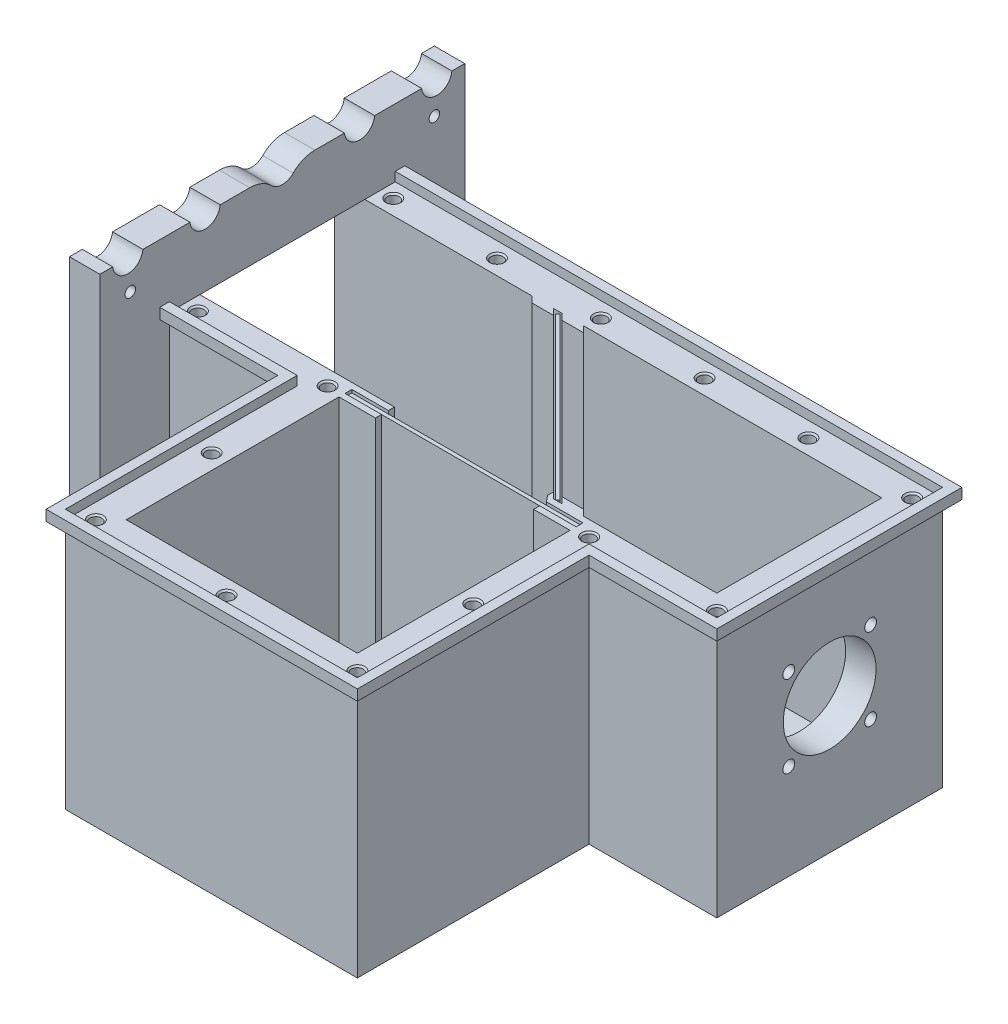
from build123d import *

# Parameters (mm, degrees)
FLOOR_2_DEPTH                         = 7
WALLS_START                           = 7
WALLS_DEPTH                           = 75.5
BEAM_START                            = 7
BEAM_SPLITTER_SUPPORTS_DEPTH          = 2
BEAM_SPLITTER_SUPPORTS_2_DEPTH        = 2
BEAM_SPLITTER_VERTICAL_SUPPORTS_DEPTH = 82.5
SM1_FLANGE_SKETCH_R                   = 15.25
SM1_FLANGE_SKETCH_R_2                 = 1.945
SM1_FLANGE_CUTOUT_DEPTH               = 10
BS_START                              = 7
BS_DIFFUSER_EXAMPLE_SKETCH_W          = 75
BS_DIFFUSER_EXAMPLE_SKETCH_H          = 1.25
BS_DIFFUSER_EXAMPLE_PLANES_DEPTH      = 75
BS_DIFFUSER_EXAMPLE_PLANES_2_DEPTH    = 75
CRYOSTAT_FLANGE_SKETCH_R              = 1.725
CRYOSTAT_FLANGE_SKETCH_W              = 54.24011537
CRYOSTAT_FLANGE_SKETCH_H              = 75.5
CRYSTAT_FLANGE_EXTRUSION_DEPTH        = 10
THREADED_INSERT_SKETCH_R              = 1.9431
CUT_EXTRUDE2_DEPTH                    = 10
CHAMFER1_SIZE                         = 0.5
BOSS_EXTRUDE12_DEPTH                  = 3
BOSS_EXTRUDE12_DEPTH_BACK             = 3
CHAMFER3_SIZE                         = 2.5
SKETCH8_R                             = 4.0767
F_1_4_20_SUPPORT_LEG_HOLES_DEPTH      = 6.35
FILLET1_R                             = 10


with BuildPart() as part:
    # Outline Sketch → Floor 2 (new body)
    with BuildSketch(Plane(origin=(0, 0, 0), x_dir=(1, 0, 0), z_dir=(0, 1, 0))):
        Polygon((10, -64.24011537), (52, -64.24011537), (52, -140.44011537), (148, -140.44011537), (148, -64.24011537), (190, -64.24011537), (190, 10), (10, 10), (10, 0), (0, 0), (0, -54.24011537), (10, -54.24011537), align=None)
    extrude(amount=FLOOR_2_DEPTH)

    # Sketch1<5> → Walls (add)
    with BuildSketch(Plane(origin=(0, 0, 0), x_dir=(1, 0, 0), z_dir=(0, 1, 0)).offset(WALLS_START)):
        Polygon((180, 0), (180, -54.24011537), (126, -54.24011537), (126, -56.24011537), (138, -56.24011537), (138, -58.49011537), (126, -58.49011537), (126, -60.49011537), (138, -60.49011537), (138, -130.44011537), (62, -130.44011537), (62, -60.49011537), (74, -60.49011537), (74, -58.49011537), (62, -58.49011537), (62, -56.24011537), (74, -56.24011537), (74, -54.24011537), (10, -54.24011537), (10, -64.24011537), (52, -64.24011537), (52, -140.44011537), (148, -140.44011537), (148, -64.24011537), (190, -64.24011537), (190, 10), (10, 10), (10, 0), align=None)
    extrude(amount=WALLS_DEPTH)



with BuildPart() as body_2:
    # Sketch1<6> → Beam Splitter Supports (new body)
    with BuildSketch(Plane(origin=(0, 0, 0), x_dir=(1, 0, 0), z_dir=(0, 1, 0)).offset(BEAM_START)):
        Polygon((81.96877708, 0), (74.897709268, 0), (129.137824638, -54.24011537), (136.20889245, -54.24011537), align=None)
    extrude(amount=BEAM_SPLITTER_SUPPORTS_DEPTH)


with BuildPart() as body_3:
    # Sketch1<6> → Beam Splitter Supports 2 (new body)
    with BuildSketch(Plane(origin=(0, 0, 0), x_dir=(1, 0, 0), z_dir=(0, 1, 0)).offset(BEAM_START)):
        Polygon((72.069282143, 0), (64.998214331, 0), (119.238329701, -54.24011537), (126.309397513, -54.24011537), align=None)
    extrude(amount=BEAM_SPLITTER_SUPPORTS_2_DEPTH)


with BuildPart() as part_1:
    add(part.part)

    add(body_2.part)  # Beam Splitter Vertical Supports merges body 2

    add(body_3.part)  # Beam Splitter Vertical Supports merges body 3
    # Outline Sketch<10> → Beam Splitter Vertical Supports (add)
    with BuildSketch(Plane(origin=(0, 0, 0), x_dir=(1, 0, 0), z_dir=(0, 1, 0))):
        Polygon((74.069282143, -2), (72.069282143, 0), (70.069282143, -2), align=None)
        Polygon((70.069282143, -2), (72.069282143, 0), (68.533748237, 0), (68.533748237, -2), align=None)
        Polygon((68.533748237, -2), (68.533748237, 0), (64.998214331, 0), (66.998214331, -2), align=None)
        Polygon((76.897709268, -2), (79.96877708, -2), (81.96877708, 0), (74.897709268, 0), align=None)
        Polygon((81.96877708, 0), (79.96877708, -2), (83.96877708, -2), align=None)
        Polygon((131.137824638, -52.24011537), (127.137824638, -52.24011537), (127.577164466, -52.679455198), (129.137824638, -54.24011537), align=None)
        Polygon((134.20889245, -52.24011537), (131.137824638, -52.24011537), (129.137824638, -54.24011537), (136.20889245, -54.24011537), align=None)
        Polygon((126, -54.24011537), (126.309397513, -54.24011537), (124.309397513, -52.24011537), (124.309397513, -54.24011537), align=None)
        Polygon((126, -56.24011537), (126, -54.24011537), (124.309397513, -54.24011537), align=None)
    extrude(amount=BEAM_SPLITTER_VERTICAL_SUPPORTS_DEPTH)

    # SM1 Flange Sketch → SM1 Flange Cutout (cut)
    with BuildSketch(Plane(origin=(190, 0, 0), x_dir=(0, 0, -1), z_dir=(1, 0, 0))):
        with Locations((-27.120057685, 44.75)):
            Circle(SM1_FLANGE_SKETCH_R)
        with Locations((-40.582057685, 58.212)):
            Circle(SM1_FLANGE_SKETCH_R_2)
        with Locations((-13.658057685, 58.212)):
            Circle(SM1_FLANGE_SKETCH_R_2)
        with Locations((-13.658057685, 31.288)):
            Circle(SM1_FLANGE_SKETCH_R_2)
        with Locations((-40.582057685, 31.288)):
            Circle(SM1_FLANGE_SKETCH_R_2)
    extrude(amount=-SM1_FLANGE_CUTOUT_DEPTH, mode=Mode.SUBTRACT)

    # Cryostat Flange Sketch → Crystat Flange Extrusion (add)
    with BuildSketch(Plane.ZY.offset(-10)):
        with BuildLine():
            Line((-28.653152905, 104.75), (-32.879942315, 104.75))
            Line((-32.879942315, 104.75), (-32.879942315, -15.25))
            Line((-32.879942315, -15.25), (87.120057685, -15.25))
            Line((87.120057685, -15.25), (87.120057685, 104.75))
            Line((87.120057685, 104.75), (82.893268275, 104.75))
            ThreePointArc((82.893268275, 104.75), (77.920057685, 100.26689112), (72.946847095, 104.75))
            Line((72.946847095, 104.75), (57.493268275, 104.75))
            ThreePointArc((57.493268275, 104.75), (52.520057685, 100.26689112), (47.546847095, 104.75))
            Line((47.546847095, 104.75), (32.093268275, 104.75))
            ThreePointArc((32.093268275, 104.75), (27.120057685, 100.26689112), (22.146847095, 104.75))
            Line((22.146847095, 104.75), (6.693268275, 104.75))
            ThreePointArc((6.693268275, 104.75), (1.720057685, 100.26689112), (-3.253152905, 104.75))
            Line((-3.253152905, 104.75), (-18.706731725, 104.75))
            ThreePointArc((-18.706731725, 104.75), (-23.679942315, 100.26689112), (-28.653152905, 104.75))
        make_face()
        with Locations((-22.879942315, -5.25)):
            Circle(CRYOSTAT_FLANGE_SKETCH_R, mode=Mode.SUBTRACT)
        with Locations((77.120057685, -5.25)):
            Circle(CRYOSTAT_FLANGE_SKETCH_R, mode=Mode.SUBTRACT)
        with Locations((27.120057685, 44.75)):
            Rectangle(CRYOSTAT_FLANGE_SKETCH_W, CRYOSTAT_FLANGE_SKETCH_H, mode=Mode.SUBTRACT)
        with Locations((-22.879942315, 94.75)):
            Circle(CRYOSTAT_FLANGE_SKETCH_R, mode=Mode.SUBTRACT)
        with Locations((77.120057685, 94.75)):
            Circle(CRYOSTAT_FLANGE_SKETCH_R, mode=Mode.SUBTRACT)
    extrude(amount=CRYSTAT_FLANGE_EXTRUSION_DEPTH)

    # Threaded Insert Sketch → Cut-Extrude2 (cut)
    with BuildSketch(Plane(origin=(0, 82.5, 0), x_dir=(1, 0, 0), z_dir=(0, 1, 0))):
        with Locations(Location((14.3688, 5, 0), (0, 0, 270))):
            Circle(THREADED_INSERT_SKETCH_R)
        with Locations(Location((48.49504, 5, 0), (0, 0, 270))):
            Circle(THREADED_INSERT_SKETCH_R)
        with Locations(Location((82.62128, 5, 0), (0, 0, 270))):
            Circle(THREADED_INSERT_SKETCH_R)
        with Locations(Location((116.74752, 5, 0), (0, 0, 270))):
            Circle(THREADED_INSERT_SKETCH_R)
        with Locations(Location((185, 5, 0), (0, 0, 270))):
            Circle(THREADED_INSERT_SKETCH_R)
        with Locations(Location((150.87376, 5, 0), (0, 0, 270))):
            Circle(THREADED_INSERT_SKETCH_R)
        with Locations(Location((185, -59.24011537, 0), (0, 0, 270))):
            Circle(THREADED_INSERT_SKETCH_R)
        with Locations(Location((143, -59.24011537, 0), (0, 0, 270))):
            Circle(THREADED_INSERT_SKETCH_R)
        with Locations(Location((143, -97.34011537, 0), (0, 0, 270))):
            Circle(THREADED_INSERT_SKETCH_R)
        with Locations(Location((100, -135.44011537, 0), (0, 0, 270))):
            Circle(THREADED_INSERT_SKETCH_R)
        with Locations(Location((143, -135.44011537, 0), (0, 0, 270))):
            Circle(THREADED_INSERT_SKETCH_R)
        with Locations(Location((57, -135.44011537, 0), (0, 0, 270))):
            Circle(THREADED_INSERT_SKETCH_R)
        with Locations(Location((57, -97.34011537, 0), (0, 0, 270))):
            Circle(THREADED_INSERT_SKETCH_R)
        with Locations(Location((57, -59.24011537, 0), (0, 0, 270))):
            Circle(THREADED_INSERT_SKETCH_R)
        with Locations(Location((14.3688, -59.24011537, 0), (0, 0, 270))):
            Circle(THREADED_INSERT_SKETCH_R)
    extrude(amount=-CUT_EXTRUDE2_DEPTH, mode=Mode.SUBTRACT)

    # Chamfer1
    chamfer1_edges = [part_1.edges().sort_by_distance(p)[0] for p in [
        (143, 82.5, 95.39701537),
        (143, 82.5, 57.29701537),
        (185, 82.5, 57.29701537),
        (150.87376, 82.5, -6.9431),
        (185, 82.5, -6.9431),
        (116.74752, 82.5, -6.9431),
        (82.62128, 82.5, -6.9431),
        (48.49504, 82.5, -6.9431),
        (100, 82.5, 133.49701537),
        (143, 82.5, 133.49701537),
        (57, 82.5, 133.49701537),
        (57, 82.5, 95.39701537),
        (57, 82.5, 57.29701537),
        (14.3688, 82.5, 57.29701537),
        (14.3688, 82.5, -6.9431),
    ]]
    chamfer(chamfer1_edges, length=CHAMFER1_SIZE)

    # Sketch8 → 1/4-20 Support Leg Holes (cut)
    with BuildSketch(Plane.XZ):
        with Locations(Location((133.175, 27.120057685, 0), (0, 0, 270))):
            Circle(SKETCH8_R)
        with Locations(Location((100, 102.94011537, 0), (0, 0, 270))):
            Circle(SKETCH8_R)
        with Locations(Location((73.175, 27.120057685, 0), (0, 0, 270))):
            Circle(SKETCH8_R)
    extrude(amount=-F_1_4_20_SUPPORT_LEG_HOLES_DEPTH, mode=Mode.SUBTRACT)

    # Fillet1
    fillet1_edges = [part_1.edges().sort_by_distance(p)[0] for p in [
        (5, 104.75, 32.093268275),
        (5, 104.75, 22.146847095),
    ]]
    fillet(fillet1_edges, radius=FILLET1_R)


with BuildPart() as body_2_2:
    # BS & Diffuser Example Sketch → BS & Diffuser Example Planes (new body)
    with BuildSketch(Plane(origin=(0, 0, 0), x_dir=(1, 0, 0), z_dir=(0, 1, 0)).offset(BS_START)):
        with Locations((100, -57.36511537)):
            Rectangle(BS_DIFFUSER_EXAMPLE_SKETCH_W, BS_DIFFUSER_EXAMPLE_SKETCH_H)
    extrude(amount=BS_DIFFUSER_EXAMPLE_PLANES_DEPTH)


with BuildPart() as body_3_2:
    # BS & Diffuser Example Sketch → BS _ Diffuser Example Planes 2 (new body)
    with BuildSketch(Plane(origin=(0, 0, 0), x_dir=(1, 0, 0), z_dir=(0, 1, 0)).offset(BS_START)):
        Polygon((127.223611076, -53.033008589), (74.190602487, 0), (73.483495706, -0.707106781), (126.516504294, -53.74011537), align=None)
    extrude(amount=BS_DIFFUSER_EXAMPLE_PLANES_2_DEPTH)


with BuildPart() as body_4:
    # Sketch7 → Boss-Extrude12 (new, two sides: drawn at the far end of the back side and taken through both)
    with BuildSketch(Plane(origin=(0, 82.5, 0), x_dir=(1, 0, 0), z_dir=(0, 1, 0)).offset(-BOSS_EXTRUDE12_DEPTH_BACK)):
        Polygon((10, 13.175), (193.175, 13.175), (193.175, -67.41511537), (151.175, -67.41511537), (151.175, -143.61511537), (48.825, -143.61511537), (48.825, -67.41511537), (10, -67.41511537), (10, -64.24011537), (52, -64.24011537), (52, -140.44011537), (148, -140.44011537), (148, -64.24011537), (190, -64.24011537), (190, 10), (10, 10), align=None)
    extrude(amount=BOSS_EXTRUDE12_DEPTH + BOSS_EXTRUDE12_DEPTH_BACK)

    # Chamfer3
    chamfer3_edges = [body_4.edges().sort_by_distance(p)[0] for p in [
        (29.4125, 79.5, 67.41511537),
        (48.825, 79.5, 105.51511537),
        (100, 79.5, 143.61511537),
        (151.175, 79.5, 105.51511537),
        (172.175, 79.5, 67.41511537),
        (193.175, 79.5, 27.120057685),
        (101.5875, 79.5, -13.175),
    ]]
    chamfer(chamfer3_edges, length=CHAMFER3_SIZE)


solid = Compound([part_1.part, body_2_2.part, body_3_2.part, body_4.part])
